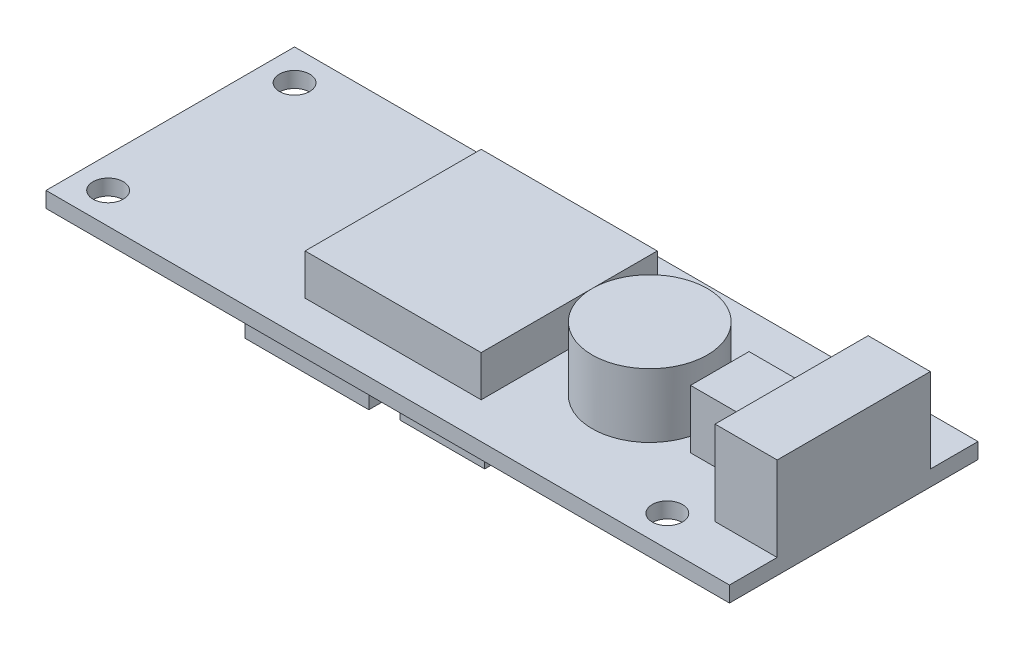
from build123d import *

# Parameters (mm, degrees)
SKETCH1_W                  = 69.85
SKETCH1_H                  = 25.4
SKETCH1_R                  = 1.5494
PCB_DEPTH                  = 1.6
TOP_FEATURES_W             = 17.9959
TOP_FEATURES_H             = 17.9959
GPS_ANTENNA_DEPTH          = 4.18
SKETCH2_3_W                = 4.74
SKETCH2_3_H                = 5.9817
JST_CONNECTOR_DEPTH        = 5.97
SKETCH2_4_W                = 6.35254
SKETCH2_4_H                = 15.64894
TERMINAL_BLOCK_DEPTH       = 8.63
BOTTOM_FEATURES_W          = 5.0038
BOTTOM_FEATURES_H          = 5.0038
CC1200_DEPTH               = 1.13
BOTTOM_FEATURES_4_W        = 12.6746
BOTTOM_FEATURES_4_H        = 10.5918
UBLOX_DEPTH                = 2.48
BOTTOM_FEATURES_5_W        = 8.636
BOTTOM_FEATURES_5_H        = 5.2705
FLASH_DEPTH                = 1.48
BOTTOM_FEATURES_6_W        = 5.04
BOTTOM_FEATURES_6_H        = 3.02
BARO_DEPTH                 = 1.22
BOTTOM_FEATURES_7_W        = 6.9723
BOTTOM_FEATURES_7_H        = 6.9723
UC_DEPTH                   = 0.87
BOTTOM_FEATURES_8_W        = 8.0391
BOTTOM_FEATURES_8_H        = 5.8293
USB_DEPTH                  = 2.57
BOTTOM_FEATURES_9_W        = 5.02666
BOTTOM_FEATURES_9_H        = 2.9972
ACCELEROMETER_DEPTH        = 1.12
TERMINALBLOCK_SOLDER_DEPTH = 2.17
TOP_FEATURES_5_R           = 5.885
BOSS_EXTRUDE13_DEPTH       = 6.53


with BuildPart() as part:
    # Sketch1 → PCB (new body)
    with BuildSketch(Plane(origin=(0, 0, 0), x_dir=(1, 0, 0), z_dir=(0, 1, 0))):
        Rectangle(SKETCH1_W, SKETCH1_H)
        with Locations((-31.75, 9.525)):
            Circle(SKETCH1_R, mode=Mode.SUBTRACT)
        with Locations((-31.75, -9.525)):
            Circle(SKETCH1_R, mode=Mode.SUBTRACT)
        with Locations((25.4, 9.525)):
            Circle(SKETCH1_R, mode=Mode.SUBTRACT)
        with Locations((25.4, -9.525)):
            Circle(SKETCH1_R, mode=Mode.SUBTRACT)
    extrude(amount=PCB_DEPTH)

    # top_features → gps_antenna (add)
    with BuildSketch(Plane(origin=(0, 1.6, 0), x_dir=(1, 0, 0), z_dir=(0, 1, 0))):
        with Locations((-3.15087, 0)):
            Rectangle(TOP_FEATURES_W, TOP_FEATURES_H)
    extrude(amount=GPS_ANTENNA_DEPTH)

    # Sketch2<3> → jst_connector (add)
    with BuildSketch(Plane(origin=(0, 1.6, 0), x_dir=(1, 0, 0), z_dir=(0, 1, 0))):
        with Locations((23.6044, 0)):
            Rectangle(SKETCH2_3_W, SKETCH2_3_H)
    extrude(amount=JST_CONNECTOR_DEPTH)

    # Sketch2<4> → terminal_block (add)
    with BuildSketch(Plane(origin=(0, 1.6, 0), x_dir=(1, 0, 0), z_dir=(0, 1, 0))):
        with Locations((31.74873, 0)):
            Rectangle(SKETCH2_4_W, SKETCH2_4_H)
    extrude(amount=TERMINAL_BLOCK_DEPTH)

    # bottom_features → cc1200 (add)
    with BuildSketch(Plane.XZ):
        with Locations((-18.6231, -2.0181)):
            Rectangle(BOTTOM_FEATURES_W, BOTTOM_FEATURES_H)
    extrude(amount=CC1200_DEPTH)

    # bottom_features<4> → ublox (add)
    with BuildSketch(Plane.XZ):
        with Locations((-9.4277, 6.2441)):
            Rectangle(BOTTOM_FEATURES_4_W, BOTTOM_FEATURES_4_H)
    extrude(amount=UBLOX_DEPTH)

    # bottom_features<5> → flash (add)
    with BuildSketch(Plane.XZ):
        with Locations((4.747, 9.22475)):
            Rectangle(BOTTOM_FEATURES_5_W, BOTTOM_FEATURES_5_H)
    extrude(amount=FLASH_DEPTH)

    # bottom_features<6> → baro (add)
    with BuildSketch(Plane.XZ):
        with Locations((13.695, 7.85)):
            Rectangle(BOTTOM_FEATURES_6_W, BOTTOM_FEATURES_6_H)
    extrude(amount=BARO_DEPTH)

    # bottom_features<7> → uC (add)
    with BuildSketch(Plane.XZ):
        with Locations((5.67885, -0.56385)):
            Rectangle(BOTTOM_FEATURES_7_W, BOTTOM_FEATURES_7_H)
    extrude(amount=UC_DEPTH)

    # bottom_features<8> → usb (add)
    with BuildSketch(Plane.XZ):
        with Locations((15.39545, -9.78535)):
            Rectangle(BOTTOM_FEATURES_8_W, BOTTOM_FEATURES_8_H)
    extrude(amount=USB_DEPTH)

    # bottom_features<9> → accelerometer (add)
    with BuildSketch(Plane.XZ):
        with Locations((-11.45833, -7.2514)):
            Rectangle(BOTTOM_FEATURES_9_W, BOTTOM_FEATURES_9_H)
    extrude(amount=ACCELEROMETER_DEPTH)

    # bottom_features<10> → terminalblock_solder (add)
    with BuildSketch(Plane.XZ):
        with BuildLine():
            Line((32.175, 6.4), (32.175, -6.4))
            ThreePointArc((32.175, -6.4), (31.315, -7.26), (30.455, -6.4))
            Line((30.455, -6.4), (30.455, 6.4))
            ThreePointArc((30.455, 6.4), (31.315, 7.26), (32.175, 6.4))
        make_face()
    extrude(amount=TERMINALBLOCK_SOLDER_DEPTH)

    # top_features<5> → Boss-Extrude13 (add)
    with BuildSketch(Plane(origin=(0, 1.6, 0), x_dir=(1, 0, 0), z_dir=(0, 1, 0))):
        with Locations((14.08, 0)):
            Circle(TOP_FEATURES_5_R)
    extrude(amount=BOSS_EXTRUDE13_DEPTH)


solid = part.part
